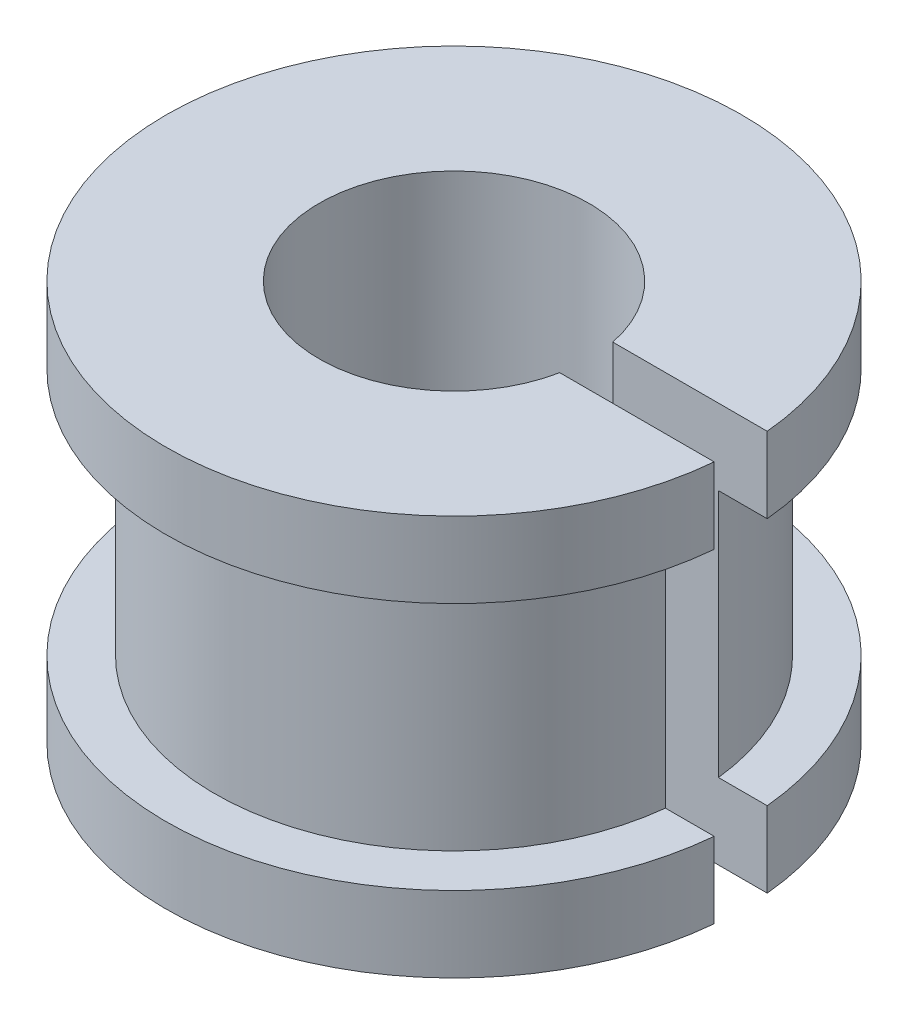
from build123d import *

# Parameters (mm, degrees)
SKETCH1_R           = 9.5
BOSS_EXTRUDE1_DEPTH = 2.5
SKETCH2_R           = 7.9
BOSS_EXTRUDE2_DEPTH = 8.2
SKETCH3_R           = 9.5
BOSS_EXTRUDE3_DEPTH = 2.5
SKETCH4_R           = 4.45
SKETCH4_W           = 10.190914757
SKETCH4_H           = 1.75
CUT_EXTRUDE1_DEPTH  = 19.834542734


with BuildPart() as part:
    # Sketch1 → Boss-Extrude1 (new body)
    with BuildSketch(Plane(origin=(0, 0, 0), x_dir=(1, 0, 0), z_dir=(0, 1, 0))):
        with Locations(Location((0, 0, 0), (0, 0, 270))):
            Circle(SKETCH1_R)
    extrude(amount=BOSS_EXTRUDE1_DEPTH)

    # Sketch2 → Boss-Extrude2 (add)
    with BuildSketch(Plane(origin=(0, 2.5, 0), x_dir=(1, 0, 0), z_dir=(0, 1, 0))):
        with Locations(Location((0, 0, 0), (0, 0, 270))):
            Circle(SKETCH2_R)
    extrude(amount=BOSS_EXTRUDE2_DEPTH)

    # Sketch3 → Boss-Extrude3 (add)
    with BuildSketch(Plane(origin=(0, 10.7, 0), x_dir=(1, 0, 0), z_dir=(0, 1, 0))):
        with Locations(Location((0, 0, 0), (0, 0, 270))):
            Circle(SKETCH3_R)
    extrude(amount=BOSS_EXTRUDE3_DEPTH)

    # Sketch4 → Cut-Extrude1 (cut, through all)
    with BuildSketch(Plane(origin=(0, 13.2, 0), x_dir=(1, 0, 0), z_dir=(0, 1, 0))):
        Circle(SKETCH4_R)
        with Locations((5.901899369, 0)):
            Rectangle(SKETCH4_W, SKETCH4_H)
    extrude(amount=-CUT_EXTRUDE1_DEPTH, mode=Mode.SUBTRACT)


solid = part.part
